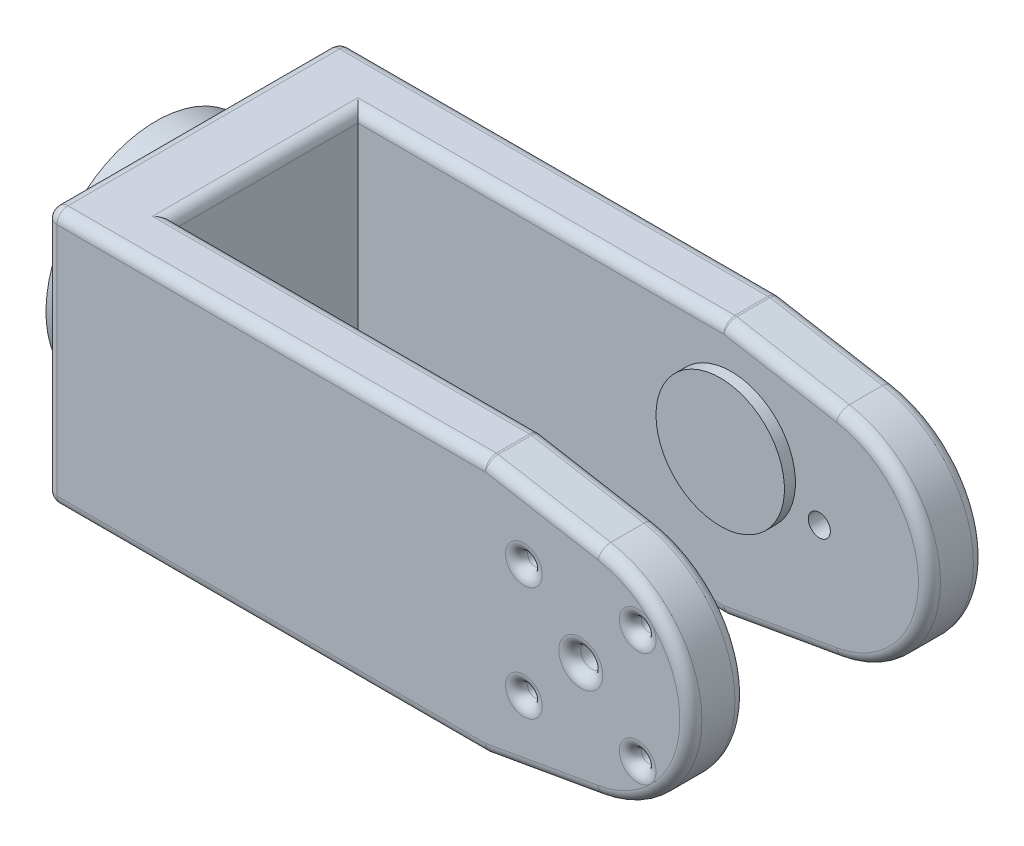
from build123d import *

# Parameters (mm, degrees)
BOSS_EXTRUDE1_DEPTH = 40
SKETCH2_W           = 199.88478884
SKETCH2_H           = 50
CUT_EXTRUDE1_DEPTH  = 184.564901716
SKETCH3_R           = 17.5
BOSS_EXTRUDE2_DEPTH = 3
SKETCH4_R           = 2
CUT_EXTRUDE2_DEPTH  = 10
SKETCH5_R           = 3
CUT_EXTRUDE3_DEPTH  = 191.228615765
SKETCH6_R           = 30
BOSS_EXTRUDE3_DEPTH = 10
SKETCH8_R           = 25
BOSS_EXTRUDE4_DEPTH = 3
FILLET1_R           = 3


with BuildPart() as part:
    # Sketch1 → Boss-Extrude1 (new, symmetric)
    with BuildSketch(Plane.XY):
        with BuildLine():
            Line((109.180570366, -50.900423512), (140.121764888, -45.444656103))
            ThreePointArc((140.121764888, -45.444656103), (164.912319558, -15.900423512), (140.121764888, 13.643809078))
            Line((140.121764888, 13.643809078), (109.180570366, 19.099576488))
            Line((109.180570366, 19.099576488), (-10.819429634, 19.099576488))
            Line((-10.819429634, 19.099576488), (-10.819429634, -50.900423512))
            Line((-10.819429634, -50.900423512), (109.180570366, -50.900423512))
        make_face()
    extrude(amount=BOSS_EXTRUDE1_DEPTH, both=True)

    # Sketch2 → Cut-Extrude1 (cut, through all)
    with BuildSketch(Plane(origin=(0, 19.099576488, 0), x_dir=(1, 0, 0), z_dir=(0, 1, 0))):
        with Locations((109.122964786, 0)):
            Rectangle(SKETCH2_W, SKETCH2_H)
    extrude(amount=-CUT_EXTRUDE1_DEPTH, mode=Mode.SUBTRACT)

    # Sketch3 → Boss-Extrude2 (add)
    with BuildSketch(Plane(origin=(0, 0, 25), x_dir=(-1, 0, 0), z_dir=(0, 0, -1))):
        with Locations(Location((-110.899594144, -9.145430559, 0), (0, 0, 180))):
            Circle(SKETCH3_R)
    boss_extrude2 = extrude(amount=BOSS_EXTRUDE2_DEPTH)

    # Mirror1: Boss-Extrude2 across plane
    add(boss_extrude2.mirror(Plane.XY))

    # Sketch4 → Cut-Extrude2 (cut)
    with BuildSketch(Plane.XY.offset(40)):
        with Locations((150.412319558, -0.400423512)):
            Circle(SKETCH4_R)
        with Locations((119.412319558, -0.400423512)):
            Circle(SKETCH4_R)
        with Locations((150.412319558, -31.400423512)):
            Circle(SKETCH4_R)
        with Locations((119.412319558, -31.400423512)):
            Circle(SKETCH4_R)
    extrude(amount=-CUT_EXTRUDE2_DEPTH, mode=Mode.SUBTRACT)

    # Sketch5 → Cut-Extrude3 (cut, through all)
    with BuildSketch(Plane.XY.offset(40)):
        with Locations((134.912319558, -15.900423512)):
            Circle(SKETCH5_R)
    extrude(amount=-CUT_EXTRUDE3_DEPTH, mode=Mode.SUBTRACT)

    # Sketch6 → Boss-Extrude3 (add)
    with BuildSketch(Plane.ZY.offset(10.819429634)):
        with Locations(Location((0, -15.900423512, 0), (0, 0, 270))):
            Circle(SKETCH6_R)
    extrude(amount=BOSS_EXTRUDE3_DEPTH)

    # Sketch8 → Boss-Extrude4 (add)
    with BuildSketch(Plane.ZY.offset(20.819429634)):
        with Locations(Location((0, -15.900423512, 0), (0, 0, 270))):
            Circle(SKETCH8_R)
    extrude(amount=BOSS_EXTRUDE4_DEPTH)

    # Fillet1
    fillet1_edges = [part.edges().sort_by_distance(p)[0] for p in [
        (109.180570366, -50.900423512, 32.5),
        (-10.819429634, -50.900423512, 0),
        (-10.819429634, 19.099576488, 0),
        (109.180570366, 19.099576488, 32.5),
        (-10.819429634, -15.900423512, 40),
        (49.180570366, -50.900423512, 40),
        (164.912319558, -15.900423512, 25),
        (164.912319558, -15.900423512, -25),
        (124.651167627, -48.172539808, 40),
        (109.180570366, -50.900423512, -32.5),
        (109.180570366, 19.099576488, -32.5),
        (164.912319558, -15.900423512, 40),
        (59.180570366, 19.099576488, 25),
        (59.180570366, 19.099576488, -25),
        (9.180570366, 19.099576488, 0),
        (124.651167627, 16.371692783, -25),
        (124.651167627, -48.172539808, -25),
        (59.180570366, -50.900423512, -25),
        (124.651167627, 16.371692783, 25),
        (59.180570366, -50.900423512, 25),
        (124.651167627, -48.172539808, 25),
        (9.180570366, -50.900423512, 0),
        (124.651167627, 16.371692783, 40),
        (117.412319558, -0.400423512, 40),
        (117.412319558, -31.400423512, 40),
        (148.412319558, -31.400423512, 40),
        (148.412319558, -0.400423512, 40),
        (164.912319558, -15.900423512, -40),
        (131.912319558, -15.900423512, -40),
        (131.912319558, -15.900423512, 40),
        (124.651167627, -48.172539808, -40),
        (49.180570366, -50.900423512, -40),
        (-10.819429634, -15.900423512, -40),
        (49.180570366, 19.099576488, -40),
        (124.651167627, 16.371692783, -40),
        (49.180570366, 19.099576488, 40),
    ]]
    fillet(fillet1_edges, radius=FILLET1_R)


solid = part.part
